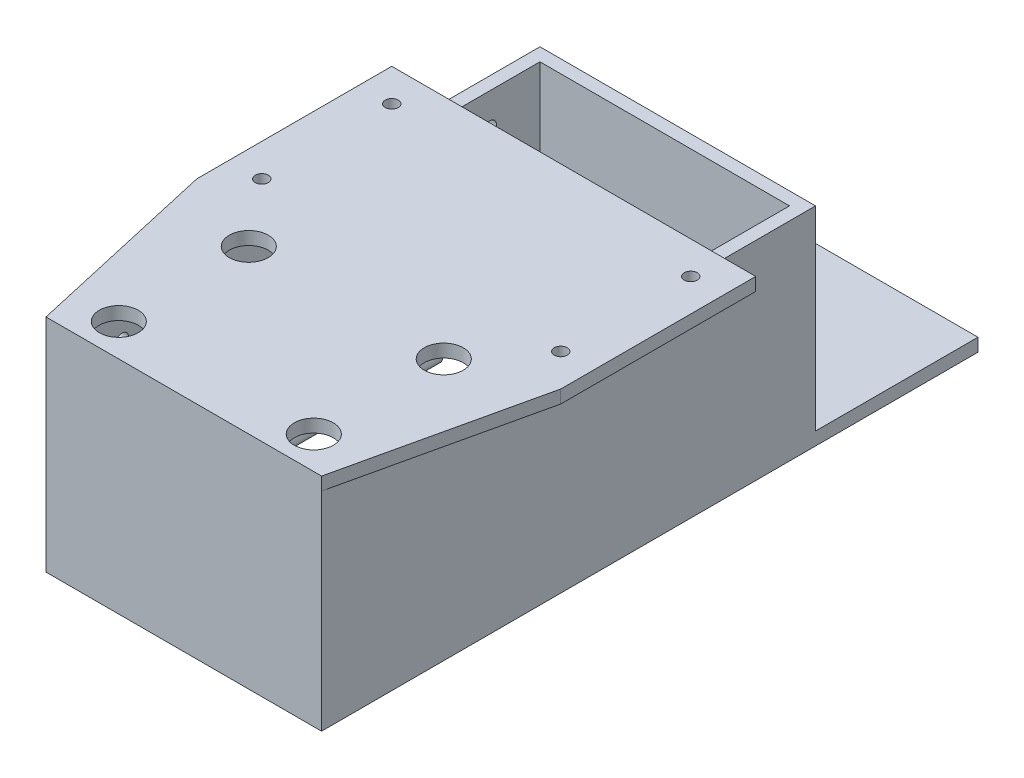
from build123d import *

# Parameters (mm, degrees)
SKETCH2_W                       = 42.4
SKETCH2_H                       = 76
SKETCH2_W_2                     = 38.4
SKETCH2_H_2                     = 72
BOSS_EXTRUDE4_DEPTH             = 32
SKETCH1_W                       = 42.4
SKETCH1_H                       = 30
SKETCH1_R                       = 3
BOSS_EXTRUDE1_DEPTH             = 2
SKETCH4_W                       = 56
SKETCH4_H                       = 30
SKETCH4_R                       = 1
BOSS_EXTRUDE5_DEPTH             = 2
SKETCH5_R                       = 1
CUT_EXTRUDE1_DEPTH              = 2
SKETCH9_W                       = 20
SKETCH9_H                       = 1
SKETCH11_W                      = 4.25
SKETCH11_H                      = 3
BOSS_EXTRUDE7_DEPTH             = 25
BOSS_EXTRUDE7_DIRECTION_2_REACH = 97.707
SKETCH12_R                      = 2
CUT_EXTRUDE2_DEPTH              = 25
CHAMFER1_SIZE                   = 1
BOSS_EXTRUDE8_DEPTH             = 2


with BuildPart() as part:
    # Sketch2 → Boss-Extrude4 (new body)
    with BuildSketch(Plane(origin=(0, 0, 0), x_dir=(1, 0, 0), z_dir=(0, 1, 0))):
        with Locations((19.2, 36)):
            Rectangle(SKETCH2_W, SKETCH2_H)
        with Locations((19.2, 36)):
            Rectangle(SKETCH2_W_2, SKETCH2_H_2, mode=Mode.SUBTRACT)
    extrude(amount=BOSS_EXTRUDE4_DEPTH)



with BuildPart() as body_2:
    # Sketch1 → Boss-Extrude1 (new body)
    with BuildSketch(Plane(origin=(0, 32, 0), x_dir=(1, 0, 0), z_dir=(0, 1, 0))):
        with Locations((19.2, 13)):
            Rectangle(SKETCH1_W, SKETCH1_H)
        with Locations(Location((4.2, 3, 0), (0, 0, 270))):
            Circle(SKETCH1_R, mode=Mode.SUBTRACT)
        with Locations(Location((34.2, 3, 0), (0, 0, 90))):
            Circle(SKETCH1_R, mode=Mode.SUBTRACT)
        with Locations(Location((34.2, 23, 0), (0, 0, 270))):
            Circle(SKETCH1_R, mode=Mode.SUBTRACT)
        with Locations(Location((4.2, 23, 0), (0, 0, 90))):
            Circle(SKETCH1_R, mode=Mode.SUBTRACT)
    extrude(amount=BOSS_EXTRUDE1_DEPTH)


with BuildPart() as part_1:
    add(part.part)

    add(body_2.part)  # Boss-Extrude5 merges body 2
    # Sketch4 → Boss-Extrude5 (add)
    with BuildSketch(Plane(origin=(0, 32, 0), x_dir=(1, 0, 0), z_dir=(0, 1, 0))):
        with Locations((19.2, 43)):
            Rectangle(SKETCH4_W, SKETCH4_H)
        with Locations(Location((-3.8, 33, 0), (0, 0, 270))):
            Circle(SKETCH4_R, mode=Mode.SUBTRACT)
        with Locations(Location((-3.8, 53, 0), (0, 0, 90))):
            Circle(SKETCH4_R, mode=Mode.SUBTRACT)
        with Locations(Location((42.2, 53, 0), (0, 0, 270))):
            Circle(SKETCH4_R, mode=Mode.SUBTRACT)
        with Locations(Location((42.2, 33, 0), (0, 0, 90))):
            Circle(SKETCH4_R, mode=Mode.SUBTRACT)
    extrude(amount=BOSS_EXTRUDE5_DEPTH)

    # Sketch5 → Cut-Extrude1 (cut)
    with BuildSketch(Plane.ZY.offset(2)):
        with Locations((-7.7, 5)):
            Circle(SKETCH5_R)
        with Locations((-7.7, 27)):
            Circle(SKETCH5_R)
        with Locations((-64.3, 27)):
            Circle(SKETCH5_R)
        with Locations((-64.3, 5)):
            Circle(SKETCH5_R)
    extrude(amount=-CUT_EXTRUDE1_DEPTH, mode=Mode.SUBTRACT)

    # Sketch9 → Revolve1 (revolve)
    with BuildSketch(Plane(origin=(0, 0, 0), x_dir=(0, 0, -1), z_dir=(1, 0, 0))):
        with Locations((46, 0.5)):
            Rectangle(SKETCH9_W, SKETCH9_H)
        with Locations((26, 0.5)):
            Rectangle(SKETCH9_W, SKETCH9_H)
    revolve1 = revolve(axis=Axis((0, 1, -56), (0, 0, 1)))

    # Mirror1: Revolve1 across plane
    add(revolve1.mirror(Plane(origin=(19.2, 0, 0), x_dir=(0, 0, 1), z_dir=(1, 0, 0))))

    # Sketch11 → Boss-Extrude7 (add)
    with BuildSketch(Plane(origin=(0, 0, -74), x_dir=(-1, 0, 0), z_dir=(0, 0, -1))):
        Polygon((-14.95, 0), (2, 0), (2, 2), (-40.4, 2), (-40.4, 0), (-23.45, 0), (-19.2, 0), align=None)
        with Locations((-21.325, -1.5)):
            Rectangle(SKETCH11_W, SKETCH11_H)
        with Locations((-17.075, -1.5)):
            Rectangle(SKETCH11_W, SKETCH11_H)
    extrude(amount=BOSS_EXTRUDE7_DEPTH)

    # Boss-Extrude7 direction 2: up to this face of the body (flat: up to its plane)
    boss_extrude7_direction_2_end = Plane(part_1.part.faces().sort_by_distance((19.2, 16, -72))[0])
    # Sketch11 → Boss-Extrude7 direction 2 (add, up to the picked face)
    with BuildSketch(Plane(origin=(0, 0, -74), x_dir=(-1, 0, 0), z_dir=(0, 0, -1)), mode=Mode.PRIVATE) as boss_extrude7_direction_2_sk1:
        Polygon((-14.95, 0), (2, 0), (2, 2), (-40.4, 2), (-40.4, 0), (-23.45, 0), (-19.2, 0), align=None)
    boss_extrude7_direction_2_tool1 = split(extrude(boss_extrude7_direction_2_sk1.sketch, amount=-BOSS_EXTRUDE7_DIRECTION_2_REACH, mode=Mode.PRIVATE), bisect_by=boss_extrude7_direction_2_end, keep=Keep.BOTH, mode=Mode.PRIVATE)
    # Sketch11 → Boss-Extrude7 direction 2 (add, up to the picked face)
    with BuildSketch(Plane(origin=(0, 0, -74), x_dir=(-1, 0, 0), z_dir=(0, 0, -1)), mode=Mode.PRIVATE) as boss_extrude7_direction_2_sk2:
        with Locations((-21.325, -1.5)):
            Rectangle(SKETCH11_W, SKETCH11_H)
    boss_extrude7_direction_2_tool2 = split(extrude(boss_extrude7_direction_2_sk2.sketch, amount=-BOSS_EXTRUDE7_DIRECTION_2_REACH, mode=Mode.PRIVATE), bisect_by=boss_extrude7_direction_2_end, keep=Keep.BOTH, mode=Mode.PRIVATE)
    # Sketch11 → Boss-Extrude7 direction 2 (add, up to the picked face)
    with BuildSketch(Plane(origin=(0, 0, -74), x_dir=(-1, 0, 0), z_dir=(0, 0, -1)), mode=Mode.PRIVATE) as boss_extrude7_direction_2_sk3:
        with Locations((-17.075, -1.5)):
            Rectangle(SKETCH11_W, SKETCH11_H)
    boss_extrude7_direction_2_tool3 = split(extrude(boss_extrude7_direction_2_sk3.sketch, amount=-BOSS_EXTRUDE7_DIRECTION_2_REACH, mode=Mode.PRIVATE), bisect_by=boss_extrude7_direction_2_end, keep=Keep.BOTH, mode=Mode.PRIVATE)
    add(boss_extrude7_direction_2_tool1.solids().sort_by(Axis((19.2, 1, -74), (0, 0, 1)))[0])
    add(boss_extrude7_direction_2_tool2.solids().sort_by(Axis((21.325, -1.5, -74), (0, 0, 1)))[0])
    add(boss_extrude7_direction_2_tool3.solids().sort_by(Axis((17.075, -1.5, -74), (0, 0, 1)))[0])

    # Sketch12 → Cut-Extrude2 (cut)
    with BuildSketch(Plane(origin=(0, 2, 0), x_dir=(1, 0, 0), z_dir=(0, 1, 0))):
        with Locations(Location((19.2, 86.5, 0), (0, 0, 270))):
            Circle(SKETCH12_R)
    extrude(amount=-CUT_EXTRUDE2_DEPTH, mode=Mode.SUBTRACT)

    # Chamfer1
    chamfer1_edges = [part_1.edges().sort_by_distance(p)[0] for p in [
        (23.45, -3, -85.5),
        (14.95, -3, -85.5),
    ]]
    chamfer(chamfer1_edges, length=CHAMFER1_SIZE)

    # Sketch13 → Boss-Extrude8 (add)
    with BuildSketch(Plane(origin=(0, 34, 0), x_dir=(1, 0, 0), z_dir=(0, 1, 0))):
        Polygon((40.4, -2), (47.2, 28), (40.4, 28), align=None)
        Polygon((-8.8, 28), (-2, 28), (-2, -2), align=None)
    extrude(amount=-BOSS_EXTRUDE8_DEPTH)


solid = part_1.part
